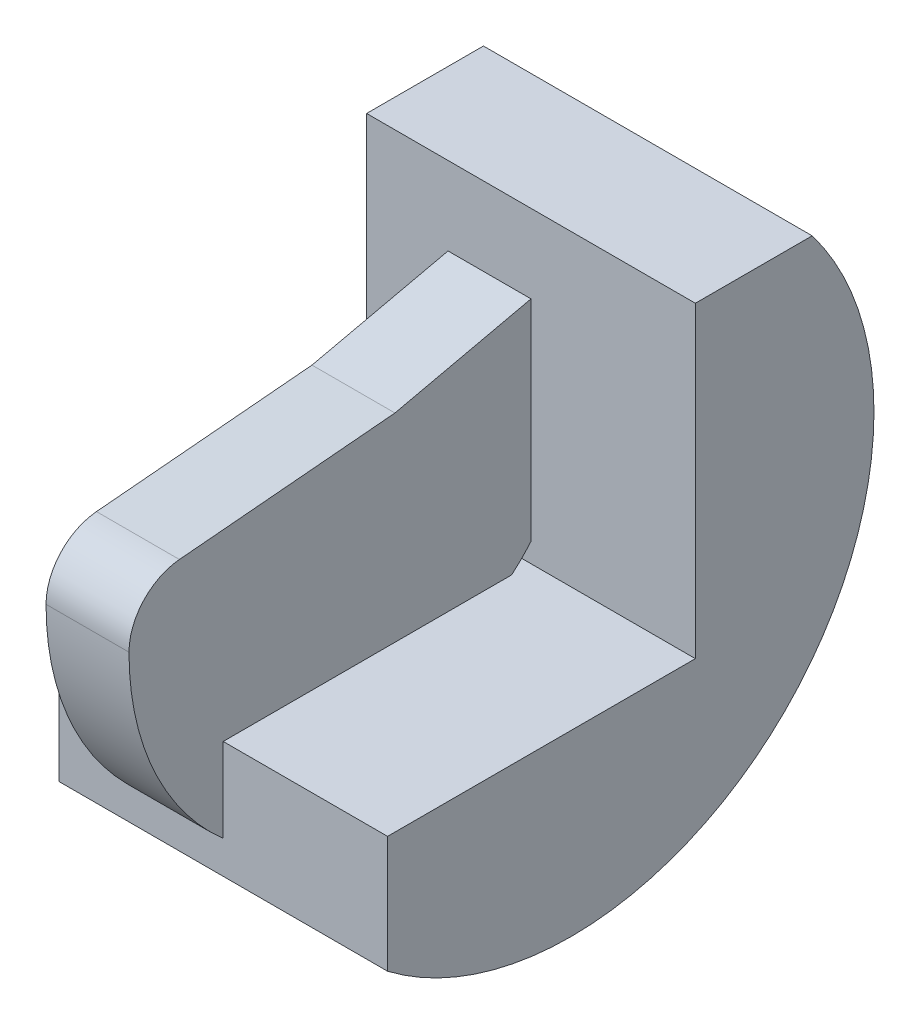
from build123d import *

# Parameters (mm, degrees)
BOSS_EXTRUDE1_DEPTH = 23.78
BOSS_EXTRUDE2_DEPTH = 6


with BuildPart() as part:
    # Sketch3 → Boss-Extrude1 (new body)
    with BuildSketch(Plane(origin=(48.18, 0, 0), x_dir=(0, 0, -1), z_dir=(1, 0, 0))):
        with BuildLine():
            Line((17.45, 13.265), (9, 13.265))
            Line((9, 13.265), (9, -9))
            Line((9, -9), (-13.265, -9))
            Line((-13.265, -9), (-13.265, -17.45))
            ThreePointArc((-13.265, -17.45), (15.499398779, -15.499398779), (17.45, 13.265))
        make_face()
    extrude(amount=-BOSS_EXTRUDE1_DEPTH)

    # Sketch4 → Boss-Extrude2 (add)
    with BuildSketch(Plane(origin=(36.29, 0, 0), x_dir=(0, 0, -1), z_dir=(1, 0, 0))):
        with BuildLine():
            Line((3.984372706, -16.433233831), (4.643364687, -9))
            Line((4.643364687, -9), (7.595, -9))
            ThreePointArc((7.595, -9), (11.734437034, -0.993485028), (9, 7.595))
            Line((9, 7.595), (-0.841557906, 5.366649873))
            Line((-0.841557906, 5.366649873), (-16.433233831, 3.984372706))
            ThreePointArc((-16.433233831, 3.984372706), (-19.030672408, 2.700654058), (-20.08, 0))
            ThreePointArc((-20.08, 0), (-14.198704166, -14.198704166), (0, -20.08))
            ThreePointArc((0, -20.08), (2.700654058, -19.030672408), (3.984372706, -16.433233831))
        make_face()
    extrude(amount=-BOSS_EXTRUDE2_DEPTH)


solid = part.part
